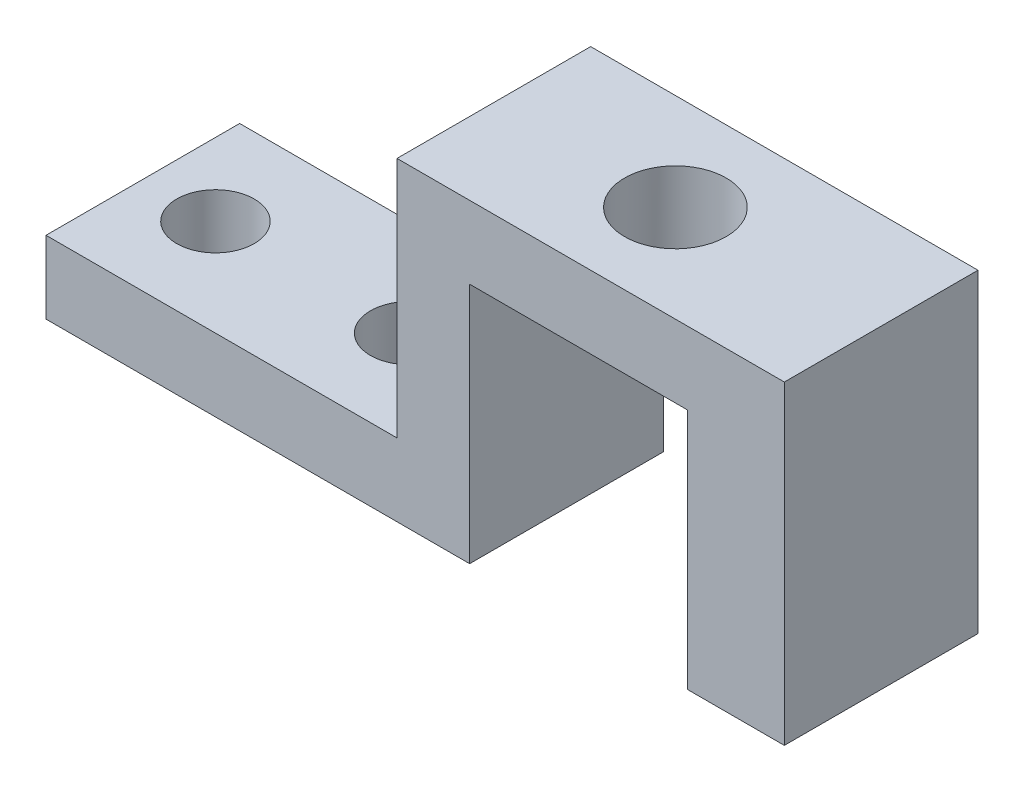
from build123d import *

# Parameters (mm, degrees)
EXTRUDE_1_DEPTH          = 8
CUT_EXTRUDE_1_DEPTH      = 34.079449814
CUT_EXTRUDE_1_DEPTH_BACK = 34.079449814
SKETCH_2_R               = 1.6
SKETCH_2_R_2             = 2.1


with BuildPart() as part:
    # 草图1 → 凸台-拉伸1 (new body)
    with BuildSketch(Plane.XY):
        Polygon((0, 0), (0, 3), (14.5, 3), (14.5, 13), (30.5, 13), (30.5, 0), (26.5, 0), (26.5, 10), (17.5, 10), (17.5, 0), align=None)
    extrude(amount=EXTRUDE_1_DEPTH)

    # 草图2 → 切除-拉伸1 (cut, two sides: drawn at the far end of the back side and taken through both)
    with BuildSketch(Plane.XZ.offset(-10).offset(-CUT_EXTRUDE_1_DEPTH_BACK)):
        with Locations((3, 4)):
            Circle(SKETCH_2_R)
        with Locations((11, 4)):
            Circle(SKETCH_2_R)
        with Locations((22, 4)):
            Circle(SKETCH_2_R_2)
    extrude(amount=CUT_EXTRUDE_1_DEPTH + CUT_EXTRUDE_1_DEPTH_BACK, mode=Mode.SUBTRACT)


solid = part.part
